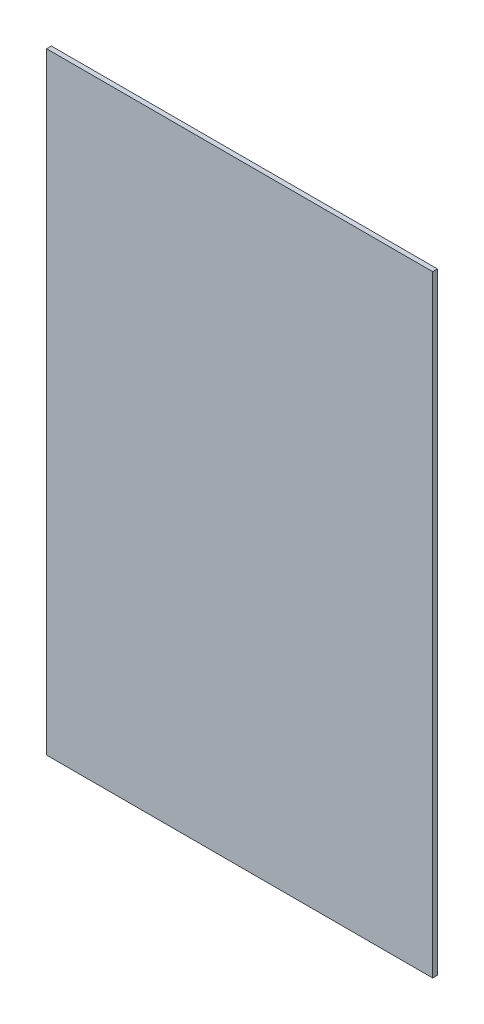
from build123d import *

# Parameters (mm, degrees)
SKETCH1_W           = 65
SKETCH1_H           = 103
BOSS_EXTRUDE1_DEPTH = 0.8


with BuildPart() as part:
    # Sketch1 → Boss-Extrude1 (new body)
    with BuildSketch(Plane.XY):
        with Locations((-20.708808224, -35)):
            Rectangle(SKETCH1_W, SKETCH1_H)
    extrude(amount=BOSS_EXTRUDE1_DEPTH)


solid = part.part
